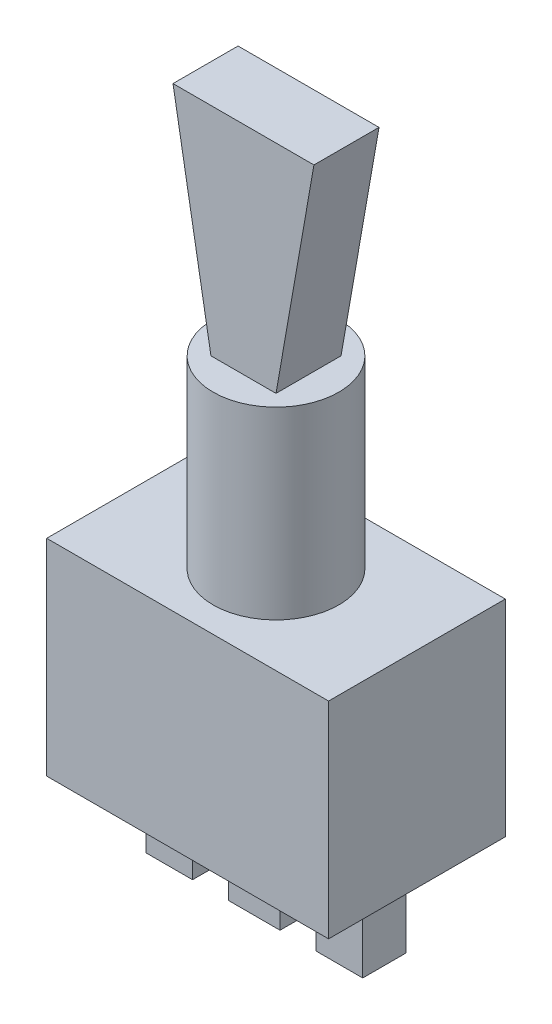
from build123d import *

# Parameters (mm, degrees)
SKETCH1_W                = 13
SKETCH1_H                = 8.15
BOSS_EXTRUDE1_DEPTH      = 9.5
SKETCH2_R                = 2.9
BOSS_EXTRUDE2_DEPTH      = 8.5
BOSS_EXTRUDE3_DEPTH      = 1.5
BOSS_EXTRUDE3_DEPTH_BACK = 1.5
SKETCH4_W                = 10
SKETCH4_H                = 2
BOSS_EXTRUDE4_DEPTH      = 3.85
CUT_EXTRUDE1_DEPTH       = 21.027621551
CUT_EXTRUDE1_DEPTH_BACK  = 21.027621551
SKETCH5_W                = 1.66278511
SKETCH5_H                = 3.85


with BuildPart() as part:
    # Sketch1 → Boss-Extrude1 (new body)
    with BuildSketch(Plane(origin=(0, 0, 0), x_dir=(1, 0, 0), z_dir=(0, 1, 0))):
        Rectangle(SKETCH1_W, SKETCH1_H)
    extrude(amount=-BOSS_EXTRUDE1_DEPTH)

    # Sketch2 → Boss-Extrude2 (add)
    with BuildSketch(Plane(origin=(0, 0, 0), x_dir=(1, 0, 0), z_dir=(0, 1, 0))):
        with Locations(Location((0, 0, 0), (0, 0, 270))):
            Circle(SKETCH2_R)
    extrude(amount=BOSS_EXTRUDE2_DEPTH)

    # Sketch3 → Boss-Extrude3 (add, two sides: drawn at the far end of the back side and taken through both)
    with BuildSketch(Plane.XY.offset(-BOSS_EXTRUDE3_DEPTH_BACK)):
        Polygon((3.25, 18.5), (-3.25, 18.5), (-1.5, 8.5), (1.5, 8.5), align=None)
    extrude(amount=BOSS_EXTRUDE3_DEPTH + BOSS_EXTRUDE3_DEPTH_BACK)

    # Sketch4 → Boss-Extrude4 (add)
    with BuildSketch(Plane.XZ.offset(9.5)):
        Rectangle(SKETCH4_W, SKETCH4_H)
    extrude(amount=BOSS_EXTRUDE4_DEPTH)

    # Sketch5 → Cut-Extrude1 (cut, two sides: drawn at the far end of the back side and taken through both)
    with BuildSketch(Plane.XY.offset(-CUT_EXTRUDE1_DEPTH_BACK)):
        with Locations((-2.017335511, -11.425)):
            Rectangle(SKETCH5_W, SKETCH5_H)
        with Locations((2.017335511, -11.425)):
            Rectangle(SKETCH5_W, SKETCH5_H)
    extrude(amount=CUT_EXTRUDE1_DEPTH + CUT_EXTRUDE1_DEPTH_BACK, mode=Mode.SUBTRACT)


solid = part.part
